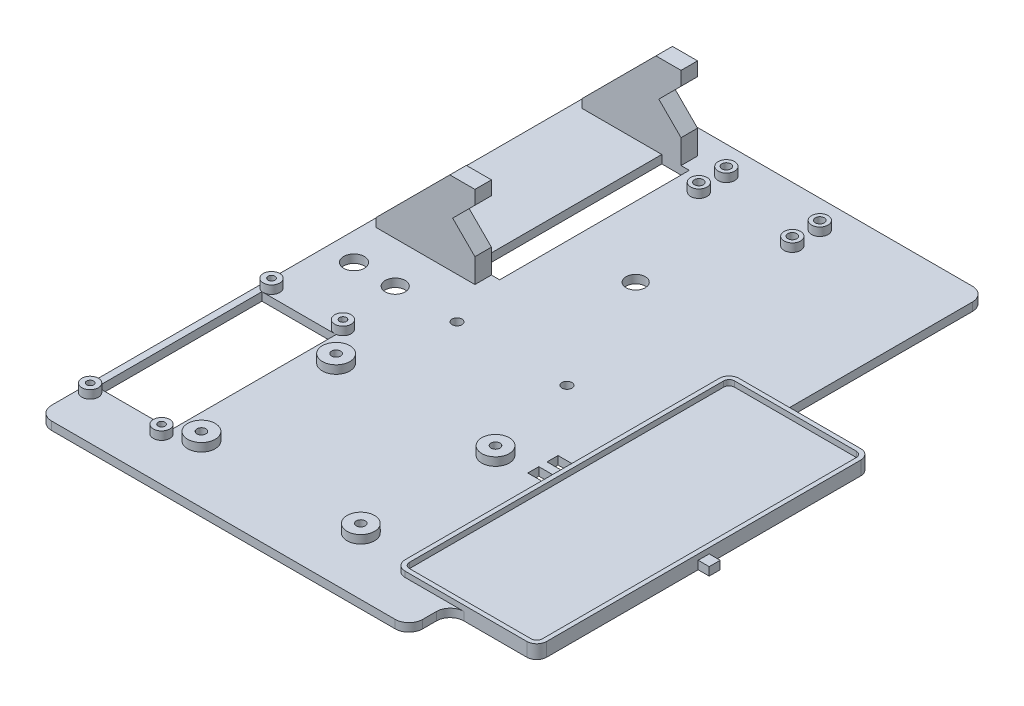
from build123d import *

# Parameters (mm, degrees)
SKETCH1_W           = 135
SKETCH1_H           = 210
BOSS_EXTRUDE1_DEPTH = 3
SKETCH2_R           = 3
SKETCH2_R_2         = 5
BOSS_EXTRUDE2_DEPTH = 3
SKETCH3_R           = 3
BOSS_EXTRUDE3_DEPTH = 3
SKETCH4_W           = 51.5
SKETCH4_H           = 121.5
BOSS_EXTRUDE4_DEPTH = 5
SKETCH5_W           = 48.3
SKETCH5_H           = 118.3
CUT_EXTRUDE1_DEPTH  = 2
FILLET1_R           = 2
FILLET2_R           = 3.6
FILLET3_R           = 5
SKETCH6_R           = 3.5
CUT_EXTRUDE2_DEPTH  = 5
SKETCH7_W           = 36
SKETCH7_H           = 6
BOSS_EXTRUDE5_DEPTH = 30
CUT_EXTRUDE3_REACH  = 228.481
CUT_EXTRUDE4_REACH  = 176.102
SKETCH9_R           = 1.625
SKETCH10_R          = 3.625
SKETCH10_R_2        = 3.75
SKETCH10_W          = 27
SKETCH10_H          = 60
CUT_EXTRUDE5_DEPTH  = 148.397421958
SKETCH11_W          = 5
SKETCH11_H          = 4
CUT_EXTRUDE6_DEPTH  = 148.397421958
SKETCH12_W          = 4
SKETCH12_H          = 4
BOSS_EXTRUDE6_DEPTH = 3
SKETCH13_W          = 10
SKETCH13_H          = 69
CUT_EXTRUDE7_DEPTH  = 151.113290551
SKETCH14_R          = 1.25
SKETCH14_R_2        = 1.625
CUT_EXTRUDE8_DEPTH  = 150.542636061
CUT_EXTRUDE9_REACH  = 189.206
CUT_EXTRUDE9_START  = -10
SKETCH15_W          = 6
SKETCH15_H          = 15
SKETCH16_R          = 1.8
CUT_EXTRUDE10_DEPTH = 151.113290551


with BuildPart() as part:
    # Sketch1 → Boss-Extrude1 (new body)
    with BuildSketch(Plane(origin=(0, 0, 0), x_dir=(1, 0, 0), z_dir=(0, 1, 0))):
        Rectangle(SKETCH1_W, SKETCH1_H)
    extrude(amount=BOSS_EXTRUDE1_DEPTH)

    # Sketch2 → Boss-Extrude2 (add)
    with BuildSketch(Plane(origin=(0, 3, 0), x_dir=(1, 0, 0), z_dir=(0, 1, 0))):
        with Locations(Location((-17, 95, 0), (0, 0, 90))):
            Circle(SKETCH2_R)
        with Locations(Location((17, 95, 0), (0, 0, 90))):
            Circle(SKETCH2_R)
        with Locations(Location((-17, 85, 0), (0, 0, 90))):
            Circle(SKETCH2_R)
        with Locations(Location((17, 85, 0), (0, 0, 90))):
            Circle(SKETCH2_R)
        with Locations(Location((-29, -35, 0), (0, 0, 90))):
            Circle(SKETCH2_R_2)
        with Locations(Location((29, -35, 0), (0, 0, 90))):
            Circle(SKETCH2_R_2)
        with Locations(Location((29, -84, 0), (0, 0, 90))):
            Circle(SKETCH2_R_2)
        with Locations(Location((-29, -84, 0), (0, 0, 90))):
            Circle(SKETCH2_R_2)
    extrude(amount=BOSS_EXTRUDE2_DEPTH)

    # Sketch3 → Boss-Extrude3 (add)
    with BuildSketch(Plane(origin=(0, 3, 0), x_dir=(1, 0, 0), z_dir=(0, 1, 0))):
        with Locations(Location((-64.5, -23, 0), (0, 0, 180))):
            Circle(SKETCH3_R)
        with Locations(Location((-38.5, -23, 0), (0, 0, 90))):
            Circle(SKETCH3_R)
        with Locations(Location((-38.5, -89, 0), (0, 0, 90))):
            Circle(SKETCH3_R)
        with Locations(Location((-64.5, -89, 0), (0, 0, 180))):
            Circle(SKETCH3_R)
    extrude(amount=BOSS_EXTRUDE3_DEPTH)

    # Sketch4 → Boss-Extrude4 (add)
    with BuildSketch(Plane.XZ):
        with Locations((73.25, 29.25)):
            Rectangle(SKETCH4_W, SKETCH4_H)
    extrude(amount=-BOSS_EXTRUDE4_DEPTH)

    # Sketch5 → Cut-Extrude1 (cut)
    with BuildSketch(Plane(origin=(0, 5, 0), x_dir=(1, 0, 0), z_dir=(0, 1, 0))):
        with Locations((73.25, -29.25)):
            Rectangle(SKETCH5_W, SKETCH5_H)
    extrude(amount=-CUT_EXTRUDE1_DEPTH, mode=Mode.SUBTRACT)

    # Fillet1
    fillet1_edges = [part.edges().sort_by_distance(p)[0] for p in [
        (49.1, 4, 88.4),
        (97.4, 4, 88.4),
        (97.4, 4, -29.9),
        (49.1, 4, -29.9),
    ]]
    fillet(fillet1_edges, radius=FILLET1_R)

    # Fillet2
    fillet2_edges = [part.edges().sort_by_distance(p)[0] for p in [
        (47.5, 4, -31.5),
        (47.5, 4, 90),
        (99, 2.5, -31.5),
        (99, 2.5, 90),
    ]]
    fillet(fillet2_edges, radius=FILLET2_R)

    # Fillet3
    fillet3_edges = [part.edges().sort_by_distance(p)[0] for p in [
        (67.5, 1.5, 90),
        (67.5, 1.5, 105),
        (-67.5, 1.5, 105),
        (-67.5, 1.5, -105),
        (67.5, 1.5, -105),
    ]]
    fillet(fillet3_edges, radius=FILLET3_R)

    # Sketch6 → Cut-Extrude2 (cut)
    with BuildSketch(Plane(origin=(0, 3, 0), x_dir=(1, 0, 0), z_dir=(0, 1, 0))):
        with Locations(Location((0, 45, 0), (0, 0, 270))):
            Circle(SKETCH6_R)
    extrude(amount=-CUT_EXTRUDE2_DEPTH, mode=Mode.SUBTRACT)

    # Sketch7 → Boss-Extrude5 (add)
    with BuildSketch(Plane(origin=(0, 3, 0), x_dir=(1, 0, 0), z_dir=(0, 1, 0))):
        with Locations((-46.494033915, 93.006908347)):
            Rectangle(SKETCH7_W, SKETCH7_H)
        with Locations((-46.494033915, 18.006908347)):
            Rectangle(SKETCH7_W, SKETCH7_H)
    extrude(amount=BOSS_EXTRUDE5_DEPTH)

    # Cut-Extrude3: up to this face of the body (flat: up to its plane)
    cut_extrude3_end = Plane(part.part.faces().sort_by_distance((-46.494033915, 18, -15.006908347))[0])
    # Sketch8 → Cut-Extrude3 (cut, up to the picked face)
    with BuildSketch(Plane(origin=(0, 0, -96.006908347), x_dir=(-1, 0, 0), z_dir=(0, 0, -1)), mode=Mode.PRIVATE) as cut_extrude3_sk1:
        Polygon((64.494033915, 33), (64.494033915, 6.129942315), (37.62397623, 33), align=None)
    cut_extrude3_tool1 = split(extrude(cut_extrude3_sk1.sketch, amount=-CUT_EXTRUDE3_REACH, mode=Mode.PRIVATE), bisect_by=cut_extrude3_end, keep=Keep.BOTH, mode=Mode.PRIVATE)
    add(cut_extrude3_tool1.solids().sort_by(Axis((-55.537348, 24.043314, -96.006908), (0, 0, 1)))[0], mode=Mode.SUBTRACT)

    # Cut-Extrude4: up to this plane
    cut_extrude4_end = Plane(origin=(-28.494033915, 33, -96.006908347), z_dir=(-1, 0, 0))
    # Sketch9 → Cut-Extrude4 (cut, up to the surface)
    with BuildSketch(Plane(origin=(-35.311988115, 35.311988115, 0), x_dir=(0, 0, 1), z_dir=(-0.7071067811865515, 0.7071067811865437, 0)), mode=Mode.PRIVATE) as cut_extrude4_sk1:
        with Locations(Location((-18.006908347, -5.269644948, 0), (0, 0, 270))):
            Circle(SKETCH9_R)
    cut_extrude4_tool1 = split(extrude(cut_extrude4_sk1.sketch, amount=-CUT_EXTRUDE4_REACH, mode=Mode.PRIVATE), bisect_by=cut_extrude4_end, keep=Keep.BOTH, mode=Mode.PRIVATE)
    add(cut_extrude4_tool1.solids().sort_by_distance((-39.03819, 31.585786, -18.006908))[0], mode=Mode.SUBTRACT)
    # Sketch9 → Cut-Extrude4 (cut, up to the surface)
    with BuildSketch(Plane(origin=(-35.311988115, 35.311988115, 0), x_dir=(0, 0, 1), z_dir=(-0.7071067811865515, 0.7071067811865437, 0)), mode=Mode.PRIVATE) as cut_extrude4_sk2:
        with Locations(Location((-93.006908347, -5.269644948, 0), (0, 0, 270))):
            Circle(SKETCH9_R)
    cut_extrude4_tool2 = split(extrude(cut_extrude4_sk2.sketch, amount=-CUT_EXTRUDE4_REACH, mode=Mode.PRIVATE), bisect_by=cut_extrude4_end, keep=Keep.BOTH, mode=Mode.PRIVATE)
    add(cut_extrude4_tool2.solids().sort_by_distance((-39.03819, 31.585786, -93.006908))[0], mode=Mode.SUBTRACT)

    # Sketch10 → Cut-Extrude5 (cut, through all)
    with BuildSketch(Plane(origin=(0, 3, 0), x_dir=(1, 0, 0), z_dir=(0, 1, 0))):
        with Locations(Location((-42.5, 0.006908347, 0), (0, 0, 270))):
            Circle(SKETCH10_R)
        with Locations(Location((-57.5, 0.006908347, 0), (0, 0, 270))):
            Circle(SKETCH10_R_2)
        with Locations((-51.5, -56)):
            Rectangle(SKETCH10_W, SKETCH10_H)
    extrude(amount=-CUT_EXTRUDE5_DEPTH, mode=Mode.SUBTRACT)

    # Sketch11 → Cut-Extrude6 (cut, through all)
    with BuildSketch(Plane(origin=(0, 3, 0), x_dir=(1, 0, 0), z_dir=(0, 1, 0))):
        with Locations((43, -25.75)):
            Rectangle(SKETCH11_W, SKETCH11_H)
        with Locations((43, -32.75)):
            Rectangle(SKETCH11_W, SKETCH11_H)
    extrude(amount=-CUT_EXTRUDE6_DEPTH, mode=Mode.SUBTRACT)

    # Sketch12 → Boss-Extrude6 (add)
    with BuildSketch(Plane.XZ):
        with Locations((101, 29.25)):
            Rectangle(SKETCH12_W, SKETCH12_H)
    extrude(amount=-BOSS_EXTRUDE6_DEPTH)

    # Sketch13 → Cut-Extrude7 (cut, through all)
    with BuildSketch(Plane(origin=(0, 3, 0), x_dir=(1, 0, 0), z_dir=(0, 1, 0))):
        with Locations((-30.494033915, 55.506908347)):
            Rectangle(SKETCH13_W, SKETCH13_H)
    extrude(amount=-CUT_EXTRUDE7_DEPTH, mode=Mode.SUBTRACT)

    # Sketch14 → Cut-Extrude8 (cut, through all)
    with BuildSketch(Plane(origin=(0, 6, 0), x_dir=(1, 0, 0), z_dir=(0, 1, 0))):
        with Locations(Location((-38.5, -89, 0), (0, 0, 270))):
            Circle(SKETCH14_R)
        with Locations(Location((-64.5, -89, 0), (0, 0, 270))):
            Circle(SKETCH14_R)
        with Locations(Location((-38.5, -23, 0), (0, 0, 270))):
            Circle(SKETCH14_R)
        with Locations(Location((-64.5, -23, 0), (0, 0, 270))):
            Circle(SKETCH14_R)
        with Locations(Location((-29, -35, 0), (0, 0, 270))):
            Circle(SKETCH14_R_2)
        with Locations(Location((-29, -84, 0), (0, 0, 270))):
            Circle(SKETCH14_R_2)
        with Locations(Location((29, -84, 0), (0, 0, 270))):
            Circle(SKETCH14_R_2)
        with Locations(Location((29, -35, 0), (0, 0, 270))):
            Circle(SKETCH14_R_2)
        with Locations(Location((17, 95, 0), (0, 0, 270))):
            Circle(SKETCH14_R_2)
        with Locations(Location((17, 85, 0), (0, 0, 270))):
            Circle(SKETCH14_R_2)
        with Locations(Location((-17, 85, 0), (0, 0, 270))):
            Circle(SKETCH14_R_2)
        with Locations(Location((-17, 95, 0), (0, 0, 270))):
            Circle(SKETCH14_R_2)
    extrude(amount=-CUT_EXTRUDE8_DEPTH, mode=Mode.SUBTRACT)

    # Cut-Extrude9: up to this face of the body (flat: up to its plane)
    cut_extrude9_end = Plane(part.part.faces().sort_by_distance((-28.494033915, 17.787931336, -93.006908347))[0])
    # Sketch15 → Cut-Extrude9 (cut, up to the picked face)
    with BuildSketch(Plane(origin=(-35.311988115, 35.311988115, 0), x_dir=(0, 0, 1), z_dir=(-0.7071067811865515, 0.7071067811865437, 0)).offset(CUT_EXTRUDE9_START), mode=Mode.PRIVATE) as cut_extrude9_sk1:
        with Locations((-93.006908347, -4.313800825)):
            Rectangle(SKETCH15_W, SKETCH15_H)
    cut_extrude9_tool1 = split(extrude(cut_extrude9_sk1.sketch, amount=-CUT_EXTRUDE9_REACH, mode=Mode.PRIVATE), bisect_by=cut_extrude9_end, keep=Keep.BOTH, mode=Mode.PRIVATE)
    # Sketch15 → Cut-Extrude9 (cut, up to the picked face)
    with BuildSketch(Plane(origin=(-35.311988115, 35.311988115, 0), x_dir=(0, 0, 1), z_dir=(-0.7071067811865515, 0.7071067811865437, 0)).offset(CUT_EXTRUDE9_START), mode=Mode.PRIVATE) as cut_extrude9_sk2:
        with Locations((-18.006908347, -4.313800825)):
            Rectangle(SKETCH15_W, SKETCH15_H)
    cut_extrude9_tool2 = split(extrude(cut_extrude9_sk2.sketch, amount=-CUT_EXTRUDE9_REACH, mode=Mode.PRIVATE), bisect_by=cut_extrude9_end, keep=Keep.BOTH, mode=Mode.PRIVATE)
    add(cut_extrude9_tool1.solids().sort_by(Axis((-31.291238, 25.190602, -93.006908), (0.7071067811865515, -0.7071067811865437, 0)))[0], mode=Mode.SUBTRACT)
    add(cut_extrude9_tool2.solids().sort_by(Axis((-31.291238, 25.190602, -18.006908), (0.7071067811865515, -0.7071067811865437, 0)))[0], mode=Mode.SUBTRACT)

    # Sketch16 → Cut-Extrude10 (cut, through all)
    with BuildSketch(Plane(origin=(0, 3, 0), x_dir=(1, 0, 0), z_dir=(0, 1, 0))):
        with Locations(Location((20, 0, 0), (0, 0, 270))):
            Circle(SKETCH16_R)
        with Locations(Location((-20, 0, 0), (0, 0, 270))):
            Circle(SKETCH16_R)
    extrude(amount=-CUT_EXTRUDE10_DEPTH, mode=Mode.SUBTRACT)


solid = part.part
